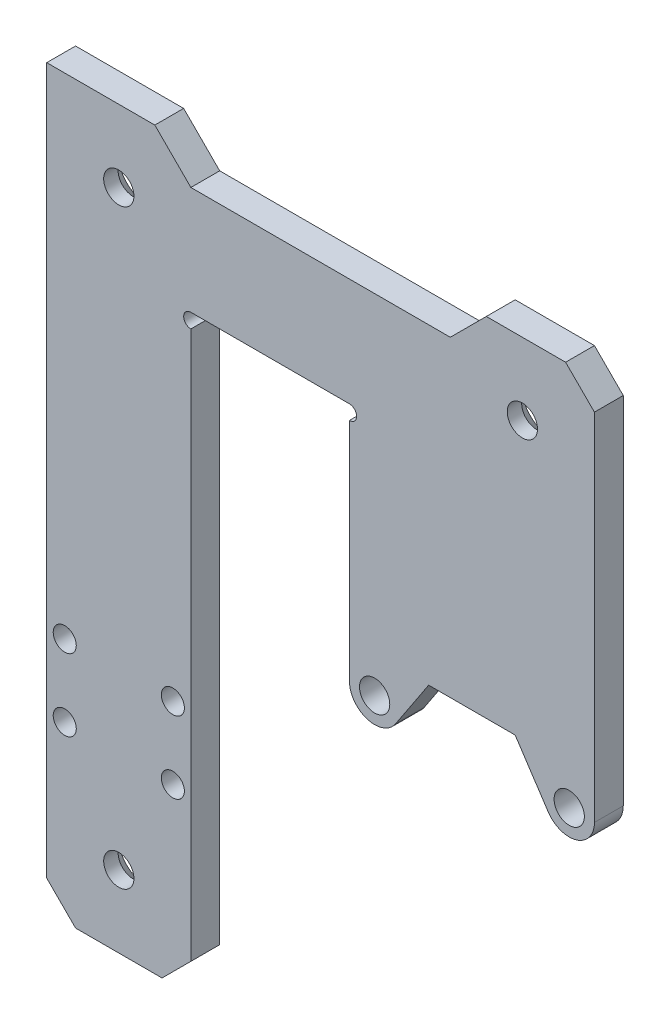
from build123d import *

# Parameters (mm, degrees)
SKETCH_1_R          = 2.1
EXTRUDE_1_DEPTH     = 2
CUT_EXTRUDE_1_DEPTH = 94.621578709
CHAMFER_1_SIZE      = 2
SKETCH_4_R          = 1
CUT_EXTRUDE_2_DEPTH = 94.621578709
CHAMFER_2_SIZE      = 4
SKETCH_7_R          = 1.6
CUT_EXTRUDE_3_DEPTH = 94.621578709


with BuildPart() as part:
    # 草图1 → 凸台-拉伸1 (new, symmetric)
    with BuildSketch(Plane.XY):
        with BuildLine():
            Line((11, 0), (-11, 0))
            Line((-11, 0), (-11, -82))
            Line((-11, -82), (-31, -82))
            Line((-31, -82), (-31, 20))
            Line((-31, 20), (45, 20))
            Line((45, 20), (45, -33.306562209))
            ThreePointArc((45, -33.306562209), (42.507569164, -36.65839818), (38.580111783, -35.236394534))
            Line((38.580111783, -35.236394534), (34, -28.306562209))
            Line((34, -28.306562209), (22, -28.306562209))
            Line((22, -28.306562209), (17.419888217, -35.236394534))
            ThreePointArc((17.419888217, -35.236394534), (13.492430836, -36.65839818), (11, -33.306562209))
            Line((11, -33.306562209), (11, 0))
        make_face()
        with Locations((-21, 10)):
            Circle(SKETCH_1_R, mode=Mode.SUBTRACT)
        with Locations((35, 10)):
            Circle(SKETCH_1_R, mode=Mode.SUBTRACT)
        with Locations((14.5, -33.306562209)):
            Circle(SKETCH_1_R, mode=Mode.SUBTRACT)
        with Locations((41.5, -33.306562209)):
            Circle(SKETCH_1_R, mode=Mode.SUBTRACT)
        with Locations((-21, -72)):
            Circle(SKETCH_1_R, mode=Mode.SUBTRACT)
    extrude(amount=EXTRUDE_1_DEPTH, both=True)

    # 草图3 → 切除-拉伸1 (cut, through all)
    with BuildSketch(Plane.XY.offset(2)):
        Polygon((-16, 20), (-11, 15), (25, 15), (30, 20), align=None)
    extrude(amount=-CUT_EXTRUDE_1_DEPTH, mode=Mode.SUBTRACT)

    # 倒角1
    chamfer_1_edges = [part.edges().sort_by_distance(p)[0] for p in [
        (-23.1, 10, -2),
        (32.9, 10, -2),
        (-23.1, -72, -2),
    ]]
    chamfer(chamfer_1_edges, length=CHAMFER_1_SIZE)

    # 草图4 → 切除-拉伸2 (cut, through all)
    with BuildSketch(Plane.XY.offset(2)):
        with Locations((-11, -1)):
            Circle(SKETCH_4_R)
        with Locations((11, -1)):
            Circle(SKETCH_4_R)
    extrude(amount=-CUT_EXTRUDE_2_DEPTH, mode=Mode.SUBTRACT)

    # 倒角2
    chamfer_2_edges = [part.edges().sort_by_distance(p)[0] for p in [
        (-11, -82, 0),
        (-31, -82, 0),
        (45, 20, 0),
    ]]
    chamfer(chamfer_2_edges, length=CHAMFER_2_SIZE)

    # 草图7 → 切除-拉伸3 (cut, through all)
    with BuildSketch(Plane.XY.offset(2)):
        with Locations((-28.5, -48)):
            Circle(SKETCH_7_R)
        with Locations((-28.5, -58)):
            Circle(SKETCH_7_R)
        with Locations((-13.5, -48)):
            Circle(SKETCH_7_R)
        with Locations((-13.5, -58)):
            Circle(SKETCH_7_R)
    extrude(amount=-CUT_EXTRUDE_3_DEPTH, mode=Mode.SUBTRACT)


solid = part.part
